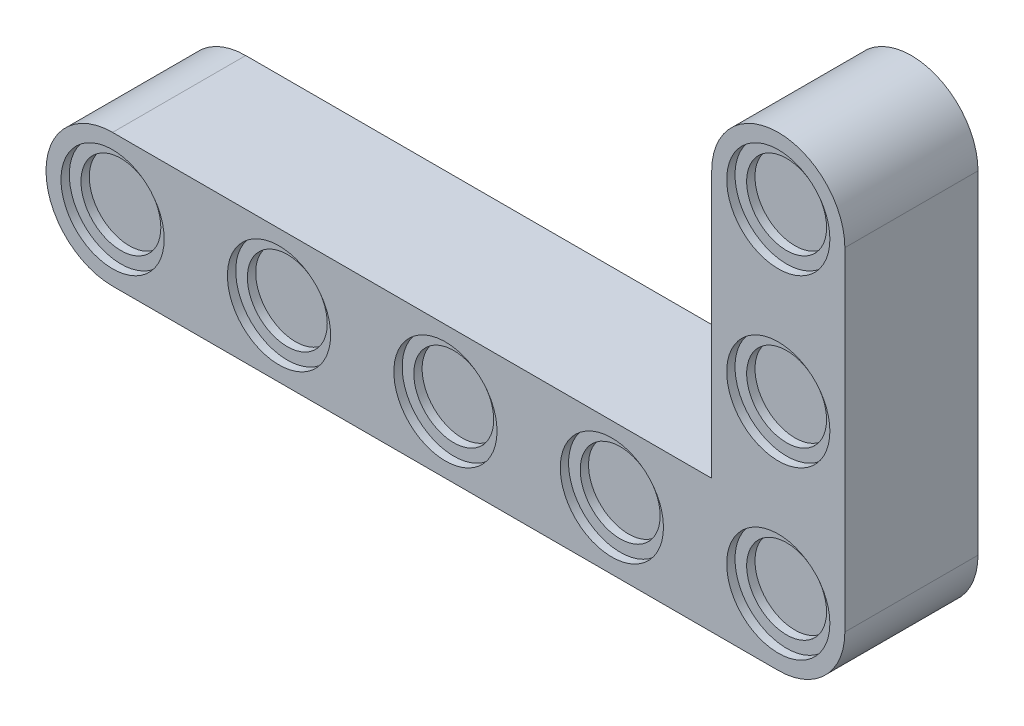
from build123d import *

# Parameters (mm, degrees)
BOSS_EXTRUDE1_DEPTH      = 8
SKETCH2_R                = 2.4
CUT_EXTRUDE1_DEPTH       = 1
SKETCH3_R                = 3.1
CUT_EXTRUDE2_DEPTH       = 0.5
LPATTERN1_COUNT          = 5
LPATTERN1_PITCH          = 10
LPATTERN1_COUNT_DIR2     = 3
LPATTERN1_PITCH_DIR2     = 10
MIRROR1_COPY_1_SKETCH_R  = 2.4
MIRROR1_COPY_1_DEPTH     = 1
MIRROR1_COPY_2_SKETCH_R  = 2.4
MIRROR1_COPY_2_DEPTH     = 1
MIRROR1_COPY_3_SKETCH_R  = 2.4
MIRROR1_COPY_3_DEPTH     = 1
MIRROR1_COPY_4_SKETCH_R  = 2.4
MIRROR1_COPY_4_DEPTH     = 1
MIRROR1_COPY_5_SKETCH_R  = 2.4
MIRROR1_COPY_5_DEPTH     = 1
MIRROR1_COPY_6_SKETCH_R  = 2.4
MIRROR1_COPY_6_DEPTH     = 1
MIRROR1_COPY_7_SKETCH_R  = 2.4
MIRROR1_COPY_7_DEPTH     = 1
MIRROR1_COPY_8_SKETCH_R  = 2.4
MIRROR1_COPY_8_DEPTH     = 1
MIRROR1_COPY_9_SKETCH_R  = 2.4
MIRROR1_COPY_9_DEPTH     = 1
MIRROR1_COPY_10_SKETCH_R = 2.4
MIRROR1_COPY_10_DEPTH    = 1
MIRROR1_COPY_11_SKETCH_R = 2.4
MIRROR1_COPY_11_DEPTH    = 1
MIRROR1_COPY_12_SKETCH_R = 2.4
MIRROR1_COPY_12_DEPTH    = 1
MIRROR1_COPY_13_SKETCH_R = 2.4
MIRROR1_COPY_13_DEPTH    = 1
MIRROR1_COPY_14_SKETCH_R = 2.4
MIRROR1_COPY_14_DEPTH    = 1
MIRROR1_COPY_15_SKETCH_R = 3.1
MIRROR1_COPY_15_DEPTH    = 0.5
MIRROR1_COPY_16_SKETCH_R = 3.1
MIRROR1_COPY_16_DEPTH    = 0.5
MIRROR1_COPY_17_SKETCH_R = 3.1
MIRROR1_COPY_17_DEPTH    = 0.5
MIRROR1_COPY_18_SKETCH_R = 3.1
MIRROR1_COPY_18_DEPTH    = 0.5
MIRROR1_COPY_19_SKETCH_R = 3.1
MIRROR1_COPY_19_DEPTH    = 0.5
MIRROR1_COPY_20_SKETCH_R = 3.1
MIRROR1_COPY_20_DEPTH    = 0.5
MIRROR1_COPY_21_SKETCH_R = 3.1
MIRROR1_COPY_21_DEPTH    = 0.5
MIRROR1_COPY_22_SKETCH_R = 3.1
MIRROR1_COPY_22_DEPTH    = 0.5
MIRROR1_COPY_23_SKETCH_R = 3.1
MIRROR1_COPY_23_DEPTH    = 0.5
MIRROR1_COPY_24_SKETCH_R = 3.1
MIRROR1_COPY_24_DEPTH    = 0.5
MIRROR1_COPY_25_SKETCH_R = 3.1
MIRROR1_COPY_25_DEPTH    = 0.5
MIRROR1_COPY_26_SKETCH_R = 3.1
MIRROR1_COPY_26_DEPTH    = 0.5
MIRROR1_COPY_27_SKETCH_R = 3.1
MIRROR1_COPY_27_DEPTH    = 0.5
MIRROR1_COPY_28_SKETCH_R = 3.1
MIRROR1_COPY_28_DEPTH    = 0.5


with BuildPart() as part:
    # Sketch1 → Boss-Extrude1 (new body)
    with BuildSketch(Plane.XY):
        with BuildLine():
            Line((0, 4), (36, 4))
            Line((36, 4), (36, 20))
            ThreePointArc((36, 20), (40, 24), (44, 20))
            Line((44, 20), (44, 0))
            ThreePointArc((44, 0), (42.828427125, -2.828427125), (40, -4))
            Line((40, -4), (0, -4))
            ThreePointArc((0, -4), (-4, 0), (0, 4))
        make_face()
    extrude(amount=-BOSS_EXTRUDE1_DEPTH)

    # Sketch2 → Cut-Extrude1 (cut)
    with BuildSketch(Plane.XY):
        Circle(SKETCH2_R)
    cut_extrude1 = extrude(amount=-CUT_EXTRUDE1_DEPTH, mode=Mode.SUBTRACT)

    # Sketch3 → Cut-Extrude2 (cut)
    with BuildSketch(Plane.XY):
        Circle(SKETCH3_R)
    cut_extrude2 = extrude(amount=-CUT_EXTRUDE2_DEPTH, mode=Mode.SUBTRACT)

    # LPattern1: Cut-Extrude1, Cut-Extrude2 5 × 3
    with Locations(*[(i * LPATTERN1_PITCH, j * LPATTERN1_PITCH_DIR2, 0) for i in range(LPATTERN1_COUNT) for j in range(LPATTERN1_COUNT_DIR2) if (i, j) != (0, 0)]):
        add(cut_extrude1, mode=Mode.SUBTRACT)
        add(cut_extrude2, mode=Mode.SUBTRACT)

    # Mirror1: Cut-Extrude1, Cut-Extrude2 across plane
    add(cut_extrude1.mirror(Plane.XY.offset(-4)), mode=Mode.SUBTRACT)
    add(cut_extrude2.mirror(Plane.XY.offset(-4)), mode=Mode.SUBTRACT)

    # Mirror1 copy 1 sketch → Mirror1 copy 1 (cut)
    with BuildSketch(Plane(origin=(0, 10, -8), x_dir=(1, 0, 0), z_dir=(0, 0, -1))):
        Circle(MIRROR1_COPY_1_SKETCH_R)
    extrude(amount=-MIRROR1_COPY_1_DEPTH, mode=Mode.SUBTRACT)

    # Mirror1 copy 2 sketch → Mirror1 copy 2 (cut)
    with BuildSketch(Plane(origin=(0, 20, -8), x_dir=(1, 0, 0), z_dir=(0, 0, -1))):
        Circle(MIRROR1_COPY_2_SKETCH_R)
    extrude(amount=-MIRROR1_COPY_2_DEPTH, mode=Mode.SUBTRACT)

    # Mirror1 copy 3 sketch → Mirror1 copy 3 (cut)
    with BuildSketch(Plane(origin=(10, 0, -8), x_dir=(1, 0, 0), z_dir=(0, 0, -1))):
        Circle(MIRROR1_COPY_3_SKETCH_R)
    extrude(amount=-MIRROR1_COPY_3_DEPTH, mode=Mode.SUBTRACT)

    # Mirror1 copy 4 sketch → Mirror1 copy 4 (cut)
    with BuildSketch(Plane(origin=(10, 10, -8), x_dir=(1, 0, 0), z_dir=(0, 0, -1))):
        Circle(MIRROR1_COPY_4_SKETCH_R)
    extrude(amount=-MIRROR1_COPY_4_DEPTH, mode=Mode.SUBTRACT)

    # Mirror1 copy 5 sketch → Mirror1 copy 5 (cut)
    with BuildSketch(Plane(origin=(10, 20, -8), x_dir=(1, 0, 0), z_dir=(0, 0, -1))):
        Circle(MIRROR1_COPY_5_SKETCH_R)
    extrude(amount=-MIRROR1_COPY_5_DEPTH, mode=Mode.SUBTRACT)

    # Mirror1 copy 6 sketch → Mirror1 copy 6 (cut)
    with BuildSketch(Plane(origin=(20, 0, -8), x_dir=(1, 0, 0), z_dir=(0, 0, -1))):
        Circle(MIRROR1_COPY_6_SKETCH_R)
    extrude(amount=-MIRROR1_COPY_6_DEPTH, mode=Mode.SUBTRACT)

    # Mirror1 copy 7 sketch → Mirror1 copy 7 (cut)
    with BuildSketch(Plane(origin=(20, 10, -8), x_dir=(1, 0, 0), z_dir=(0, 0, -1))):
        Circle(MIRROR1_COPY_7_SKETCH_R)
    extrude(amount=-MIRROR1_COPY_7_DEPTH, mode=Mode.SUBTRACT)

    # Mirror1 copy 8 sketch → Mirror1 copy 8 (cut)
    with BuildSketch(Plane(origin=(20, 20, -8), x_dir=(1, 0, 0), z_dir=(0, 0, -1))):
        Circle(MIRROR1_COPY_8_SKETCH_R)
    extrude(amount=-MIRROR1_COPY_8_DEPTH, mode=Mode.SUBTRACT)

    # Mirror1 copy 9 sketch → Mirror1 copy 9 (cut)
    with BuildSketch(Plane(origin=(30, 0, -8), x_dir=(1, 0, 0), z_dir=(0, 0, -1))):
        Circle(MIRROR1_COPY_9_SKETCH_R)
    extrude(amount=-MIRROR1_COPY_9_DEPTH, mode=Mode.SUBTRACT)

    # Mirror1 copy 10 sketch → Mirror1 copy 10 (cut)
    with BuildSketch(Plane(origin=(30, 10, -8), x_dir=(1, 0, 0), z_dir=(0, 0, -1))):
        Circle(MIRROR1_COPY_10_SKETCH_R)
    extrude(amount=-MIRROR1_COPY_10_DEPTH, mode=Mode.SUBTRACT)

    # Mirror1 copy 11 sketch → Mirror1 copy 11 (cut)
    with BuildSketch(Plane(origin=(30, 20, -8), x_dir=(1, 0, 0), z_dir=(0, 0, -1))):
        Circle(MIRROR1_COPY_11_SKETCH_R)
    extrude(amount=-MIRROR1_COPY_11_DEPTH, mode=Mode.SUBTRACT)

    # Mirror1 copy 12 sketch → Mirror1 copy 12 (cut)
    with BuildSketch(Plane(origin=(40, 0, -8), x_dir=(1, 0, 0), z_dir=(0, 0, -1))):
        Circle(MIRROR1_COPY_12_SKETCH_R)
    extrude(amount=-MIRROR1_COPY_12_DEPTH, mode=Mode.SUBTRACT)

    # Mirror1 copy 13 sketch → Mirror1 copy 13 (cut)
    with BuildSketch(Plane(origin=(40, 10, -8), x_dir=(1, 0, 0), z_dir=(0, 0, -1))):
        Circle(MIRROR1_COPY_13_SKETCH_R)
    extrude(amount=-MIRROR1_COPY_13_DEPTH, mode=Mode.SUBTRACT)

    # Mirror1 copy 14 sketch → Mirror1 copy 14 (cut)
    with BuildSketch(Plane(origin=(40, 20, -8), x_dir=(1, 0, 0), z_dir=(0, 0, -1))):
        Circle(MIRROR1_COPY_14_SKETCH_R)
    extrude(amount=-MIRROR1_COPY_14_DEPTH, mode=Mode.SUBTRACT)

    # Mirror1 copy 15 sketch → Mirror1 copy 15 (cut)
    with BuildSketch(Plane(origin=(0, 10, -8), x_dir=(1, 0, 0), z_dir=(0, 0, -1))):
        Circle(MIRROR1_COPY_15_SKETCH_R)
    extrude(amount=-MIRROR1_COPY_15_DEPTH, mode=Mode.SUBTRACT)

    # Mirror1 copy 16 sketch → Mirror1 copy 16 (cut)
    with BuildSketch(Plane(origin=(0, 20, -8), x_dir=(1, 0, 0), z_dir=(0, 0, -1))):
        Circle(MIRROR1_COPY_16_SKETCH_R)
    extrude(amount=-MIRROR1_COPY_16_DEPTH, mode=Mode.SUBTRACT)

    # Mirror1 copy 17 sketch → Mirror1 copy 17 (cut)
    with BuildSketch(Plane(origin=(10, 0, -8), x_dir=(1, 0, 0), z_dir=(0, 0, -1))):
        Circle(MIRROR1_COPY_17_SKETCH_R)
    extrude(amount=-MIRROR1_COPY_17_DEPTH, mode=Mode.SUBTRACT)

    # Mirror1 copy 18 sketch → Mirror1 copy 18 (cut)
    with BuildSketch(Plane(origin=(10, 10, -8), x_dir=(1, 0, 0), z_dir=(0, 0, -1))):
        Circle(MIRROR1_COPY_18_SKETCH_R)
    extrude(amount=-MIRROR1_COPY_18_DEPTH, mode=Mode.SUBTRACT)

    # Mirror1 copy 19 sketch → Mirror1 copy 19 (cut)
    with BuildSketch(Plane(origin=(10, 20, -8), x_dir=(1, 0, 0), z_dir=(0, 0, -1))):
        Circle(MIRROR1_COPY_19_SKETCH_R)
    extrude(amount=-MIRROR1_COPY_19_DEPTH, mode=Mode.SUBTRACT)

    # Mirror1 copy 20 sketch → Mirror1 copy 20 (cut)
    with BuildSketch(Plane(origin=(20, 0, -8), x_dir=(1, 0, 0), z_dir=(0, 0, -1))):
        Circle(MIRROR1_COPY_20_SKETCH_R)
    extrude(amount=-MIRROR1_COPY_20_DEPTH, mode=Mode.SUBTRACT)

    # Mirror1 copy 21 sketch → Mirror1 copy 21 (cut)
    with BuildSketch(Plane(origin=(20, 10, -8), x_dir=(1, 0, 0), z_dir=(0, 0, -1))):
        Circle(MIRROR1_COPY_21_SKETCH_R)
    extrude(amount=-MIRROR1_COPY_21_DEPTH, mode=Mode.SUBTRACT)

    # Mirror1 copy 22 sketch → Mirror1 copy 22 (cut)
    with BuildSketch(Plane(origin=(20, 20, -8), x_dir=(1, 0, 0), z_dir=(0, 0, -1))):
        Circle(MIRROR1_COPY_22_SKETCH_R)
    extrude(amount=-MIRROR1_COPY_22_DEPTH, mode=Mode.SUBTRACT)

    # Mirror1 copy 23 sketch → Mirror1 copy 23 (cut)
    with BuildSketch(Plane(origin=(30, 0, -8), x_dir=(1, 0, 0), z_dir=(0, 0, -1))):
        Circle(MIRROR1_COPY_23_SKETCH_R)
    extrude(amount=-MIRROR1_COPY_23_DEPTH, mode=Mode.SUBTRACT)

    # Mirror1 copy 24 sketch → Mirror1 copy 24 (cut)
    with BuildSketch(Plane(origin=(30, 10, -8), x_dir=(1, 0, 0), z_dir=(0, 0, -1))):
        Circle(MIRROR1_COPY_24_SKETCH_R)
    extrude(amount=-MIRROR1_COPY_24_DEPTH, mode=Mode.SUBTRACT)

    # Mirror1 copy 25 sketch → Mirror1 copy 25 (cut)
    with BuildSketch(Plane(origin=(30, 20, -8), x_dir=(1, 0, 0), z_dir=(0, 0, -1))):
        Circle(MIRROR1_COPY_25_SKETCH_R)
    extrude(amount=-MIRROR1_COPY_25_DEPTH, mode=Mode.SUBTRACT)

    # Mirror1 copy 26 sketch → Mirror1 copy 26 (cut)
    with BuildSketch(Plane(origin=(40, 0, -8), x_dir=(1, 0, 0), z_dir=(0, 0, -1))):
        Circle(MIRROR1_COPY_26_SKETCH_R)
    extrude(amount=-MIRROR1_COPY_26_DEPTH, mode=Mode.SUBTRACT)

    # Mirror1 copy 27 sketch → Mirror1 copy 27 (cut)
    with BuildSketch(Plane(origin=(40, 10, -8), x_dir=(1, 0, 0), z_dir=(0, 0, -1))):
        Circle(MIRROR1_COPY_27_SKETCH_R)
    extrude(amount=-MIRROR1_COPY_27_DEPTH, mode=Mode.SUBTRACT)

    # Mirror1 copy 28 sketch → Mirror1 copy 28 (cut)
    with BuildSketch(Plane(origin=(40, 20, -8), x_dir=(1, 0, 0), z_dir=(0, 0, -1))):
        Circle(MIRROR1_COPY_28_SKETCH_R)
    extrude(amount=-MIRROR1_COPY_28_DEPTH, mode=Mode.SUBTRACT)


solid = part.part
